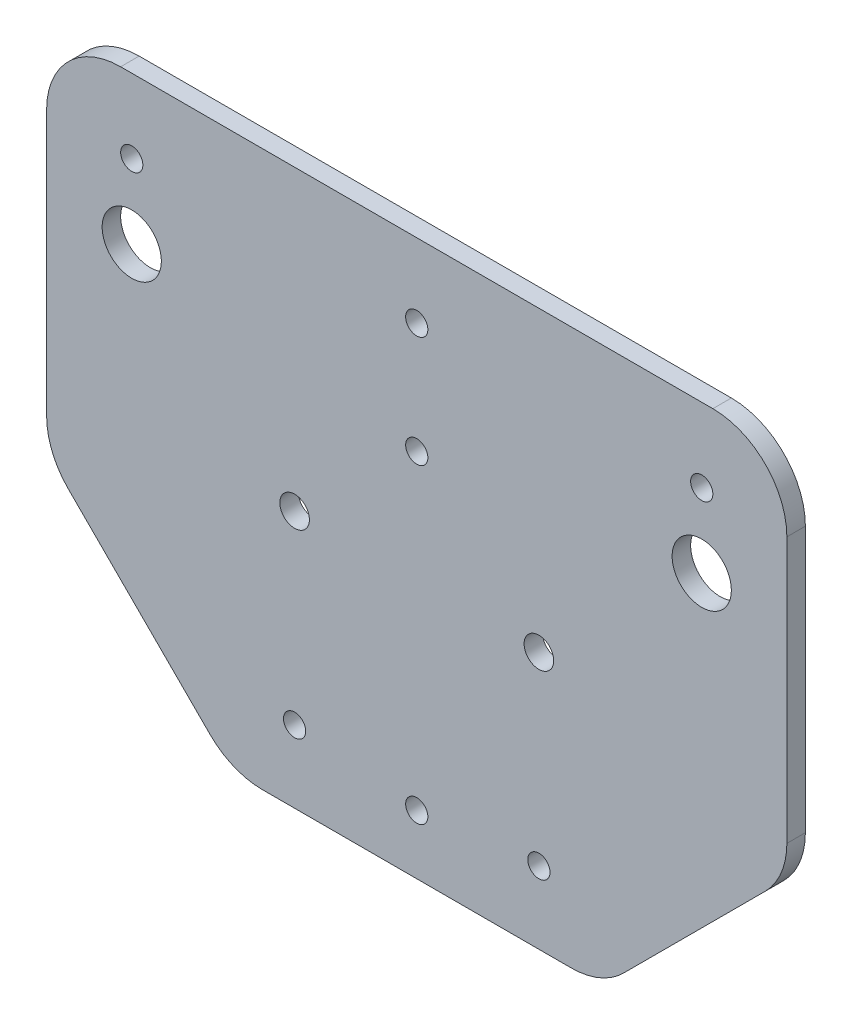
from build123d import *

# Parameters (mm, degrees)
SKETCH1_3_R         = 1.5
SKETCH1_3_R_2       = 2
SKETCH1_3_R_3       = 4
BOSS_EXTRUDE2_DEPTH = 1.25
FILLET2_R           = 10


with BuildPart() as part:
    # Sketch1<3> → Boss-Extrude2 (new, symmetric)
    with BuildSketch(Plane.XY):
        Polygon((50, -12.5), (50, 37.5), (-50, 37.5), (-50, -12.5), (-25, -37.5), (25, -37.5), align=None)
        with Locations((-16.5, -27.75)):
            Circle(SKETCH1_3_R, mode=Mode.SUBTRACT)
        with Locations((0, -29.5)):
            Circle(SKETCH1_3_R, mode=Mode.SUBTRACT)
        with Locations((16.5, -27.75)):
            Circle(SKETCH1_3_R, mode=Mode.SUBTRACT)
        with Locations((16.5, -2.75)):
            Circle(SKETCH1_3_R_2, mode=Mode.SUBTRACT)
        with Locations((-38.5, 17.5)):
            Circle(SKETCH1_3_R_3, mode=Mode.SUBTRACT)
        with Locations((-38.5, 27.5)):
            Circle(SKETCH1_3_R, mode=Mode.SUBTRACT)
        with Locations((0, 12.5)):
            Circle(SKETCH1_3_R, mode=Mode.SUBTRACT)
        with Locations((38.5, 17.5)):
            Circle(SKETCH1_3_R_3, mode=Mode.SUBTRACT)
        with Locations((0, 27.5)):
            Circle(SKETCH1_3_R, mode=Mode.SUBTRACT)
        with Locations((38.5, 27.5)):
            Circle(SKETCH1_3_R, mode=Mode.SUBTRACT)
        with Locations((-16.5, -2.75)):
            Circle(SKETCH1_3_R_2, mode=Mode.SUBTRACT)
    extrude(amount=BOSS_EXTRUDE2_DEPTH, both=True)

    # Fillet2
    fillet2_edges = [part.edges().sort_by_distance(p)[0] for p in [
        (50, -12.5, 0),
        (25, -37.5, 0),
        (-25, -37.5, 0),
        (-50, -12.5, 0),
        (-50, 37.5, 0),
        (50, 37.5, 0),
    ]]
    fillet(fillet2_edges, radius=FILLET2_R)


solid = part.part
